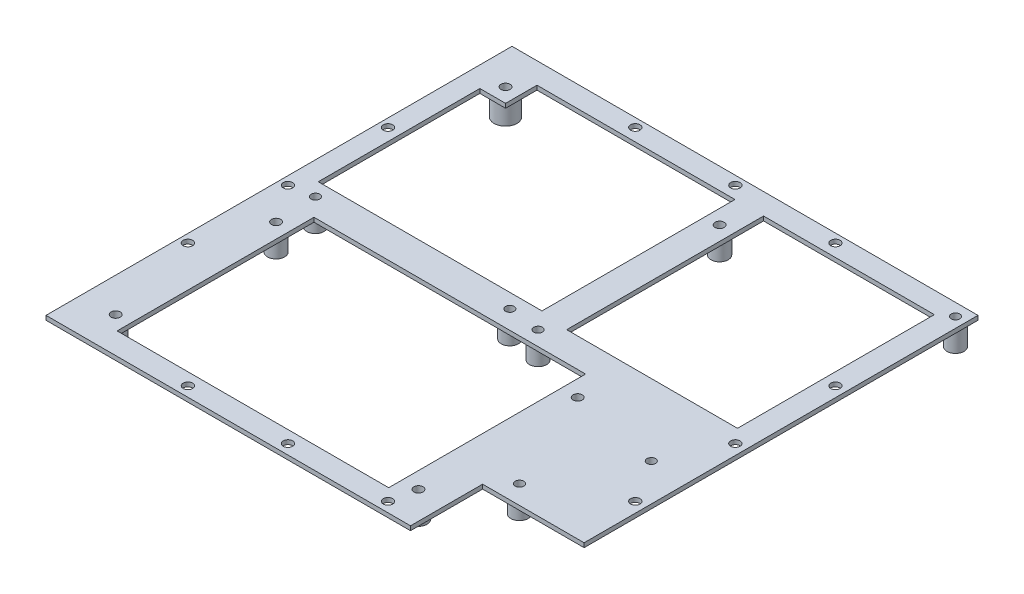
from build123d import *

# Parameters (mm, degrees)
CROQUIS1_R              = 1.6
CROQUIS1_R_2            = 1.65
CROQUIS1_W              = 95
CROQUIS1_H              = 68.859019413
CROQUIS1_R_3            = 1.5
CROQUIS1_W_2            = 59.75
SALIENTE_EXTRUIR2_DEPTH = 1.5
CROQUIS4_R              = 3
CROQUIS4_R_2            = 4
SALIENTE_EXTRUIR3_DEPTH = 7.6
CORTAR_EXTRUIR2_START   = -17.6
CROQUIS5_R              = 1.6
CROQUIS5_R_2            = 1.5
CORTAR_EXTRUIR2_DEPTH   = 17.6


with BuildPart() as part:
    # Croquis1 → Saliente-Extruir2 (new body)
    with BuildSketch(Plane(origin=(0, 0, 0), x_dir=(1, 0, 0), z_dir=(0, 1, 0))):
        Polygon((-81.153068025, 81.276875237), (-81.153068025, -81.723124763), (46.345958321, -81.723124763), (46.345958321, -56.5), (81.846931975, -56.5), (81.846931975, 81.276875237), align=None)
        with Locations(Location((-69.2, -69.3, 0), (0, 0, 270))):
            Circle(CROQUIS1_R, mode=Mode.SUBTRACT)
        with Locations(Location((-35, -78.25, 0), (0, 0, 270))):
            Circle(CROQUIS1_R_2, mode=Mode.SUBTRACT)
        with Locations(Location((0, -78.25, 0), (0, 0, 270))):
            Circle(CROQUIS1_R_2, mode=Mode.SUBTRACT)
        with Locations(Location((-78.25, -35, 0), (0, 0, 270))):
            Circle(CROQUIS1_R_2, mode=Mode.SUBTRACT)
        with Locations(Location((-69.2, -13.2, 0), (0, 0, 270))):
            Circle(CROQUIS1_R, mode=Mode.SUBTRACT)
        with Locations((-16.5, -39.570490294)):
            Rectangle(CROQUIS1_W, CROQUIS1_H, mode=Mode.SUBTRACT)
        with Locations(Location((35, -78.25, 0), (0, 0, 270))):
            Circle(CROQUIS1_R_2, mode=Mode.SUBTRACT)
        with Locations(Location((36.7, -69.3, 0), (0, 0, 270))):
            Circle(CROQUIS1_R, mode=Mode.SUBTRACT)
        with Locations(Location((52.645958321, -49.9, 0), (0, 0, 270))):
            Circle(CROQUIS1_R_3, mode=Mode.SUBTRACT)
        with Locations(Location((36.7, -13.6, 0), (0, 0, 270))):
            Circle(CROQUIS1_R, mode=Mode.SUBTRACT)
        with Locations(Location((78.25, -35, 0), (0, 0, 270))):
            Circle(CROQUIS1_R_2, mode=Mode.SUBTRACT)
        with Locations(Location((68.845958321, -20, 0), (0, 0, 270))):
            Circle(CROQUIS1_R_3, mode=Mode.SUBTRACT)
        with Locations(Location((-78.25, 0, 0), (0, 0, 270))):
            Circle(CROQUIS1_R_2, mode=Mode.SUBTRACT)
        with Locations(Location((-70, 1.359281772, 0), (0, 0, 270))):
            Circle(CROQUIS1_R_3, mode=Mode.SUBTRACT)
        with Locations(Location((-78.25, 35, 0), (0, 0, 270))):
            Circle(CROQUIS1_R_2, mode=Mode.SUBTRACT)
        with Locations(Location((-2, 1.359281772, 0), (0, 0, 270))):
            Circle(CROQUIS1_R_3, mode=Mode.SUBTRACT)
        Polygon((-74, 62.876032496), (-65, 62.876032496), (-65, 73.859019413), (4.25, 73.859019413), (4.25, 6.359281772), (-65, 6.359281772), (-74, 6.359281772), align=None, mode=Mode.SUBTRACT)
        with Locations(Location((-70, 67.859019413, 0), (0, 0, 270))):
            Circle(CROQUIS1_R_3, mode=Mode.SUBTRACT)
        with Locations(Location((-35, 78.25, 0), (0, 0, 270))):
            Circle(CROQUIS1_R_2, mode=Mode.SUBTRACT)
        with Locations(Location((0, 78.25, 0), (0, 0, 270))):
            Circle(CROQUIS1_R_2, mode=Mode.SUBTRACT)
        with Locations(Location((9.25, 0, 0), (0, 0, 270))):
            Circle(CROQUIS1_R_3, mode=Mode.SUBTRACT)
        with Locations(Location((78.25, 0, 0), (0, 0, 270))):
            Circle(CROQUIS1_R_2, mode=Mode.SUBTRACT)
        with Locations((44.125, 39.429509706)):
            Rectangle(CROQUIS1_W_2, CROQUIS1_H, mode=Mode.SUBTRACT)
        with Locations(Location((78.25, 35, 0), (0, 0, 270))):
            Circle(CROQUIS1_R_2, mode=Mode.SUBTRACT)
        with Locations(Location((9.25, 63.5, 0), (0, 0, 270))):
            Circle(CROQUIS1_R_3, mode=Mode.SUBTRACT)
        with Locations(Location((35, 78.25, 0), (0, 0, 270))):
            Circle(CROQUIS1_R_2, mode=Mode.SUBTRACT)
        with Locations(Location((78.25, 76.999306834, 0), (0, 0, 270))):
            Circle(CROQUIS1_R_3, mode=Mode.SUBTRACT)
    extrude(amount=SALIENTE_EXTRUIR2_DEPTH)

    # Croquis4 → Saliente-Extruir3 (add)
    with BuildSketch(Plane.XZ):
        with Locations(Location((-69.2, 69.3, 0), (0, 0, 90))):
            Circle(CROQUIS4_R)
        with Locations(Location((-69.2, 13.2, 0), (0, 0, 90))):
            Circle(CROQUIS4_R)
        with Locations(Location((36.7, 13.6, 0), (0, 0, 90))):
            Circle(CROQUIS4_R)
        with Locations(Location((52.645958321, 49.9, 0), (0, 0, 90))):
            Circle(CROQUIS4_R)
        with Locations(Location((68.845958321, 20, 0), (0, 0, 90))):
            Circle(CROQUIS4_R)
        with Locations(Location((9.25, 0, 0), (0, 0, 90))):
            Circle(CROQUIS4_R)
        with Locations(Location((-2, -1.359281772, 0), (0, 0, 90))):
            Circle(CROQUIS4_R)
        with Locations(Location((-70, -1.359281772, 0), (0, 0, 90))):
            Circle(CROQUIS4_R)
        with Locations(Location((-70, -67.859019413, 0), (0, 0, 90))):
            Circle(CROQUIS4_R_2)
        with Locations(Location((9.25, -63.5, 0), (0, 0, 90))):
            Circle(CROQUIS4_R)
        with Locations(Location((78.25, -76.999306834, 0), (0, 0, 90))):
            Circle(CROQUIS4_R)
        with Locations(Location((36.7, 69.3, 0), (0, 0, 90))):
            Circle(CROQUIS4_R)
    extrude(amount=SALIENTE_EXTRUIR3_DEPTH)

    # Croquis5 → Cortar-Extruir2 (cut)
    with BuildSketch(Plane(origin=(0, 1.5, 0), x_dir=(1, 0, 0), z_dir=(0, 1, 0)).offset(CORTAR_EXTRUIR2_START)):
        with Locations(Location((-69.2, -13.2, 0), (0, 0, 90))):
            Circle(CROQUIS5_R)
        with Locations(Location((-70, 1.359281772, 0), (0, 0, 90))):
            Circle(CROQUIS5_R_2)
        with Locations(Location((-2, 1.359281772, 0), (0, 0, 90))):
            Circle(CROQUIS5_R_2)
        with Locations(Location((9.25, 0, 0), (0, 0, 90))):
            Circle(CROQUIS5_R_2)
        with Locations(Location((36.7, -13.6, 0), (0, 0, 90))):
            Circle(CROQUIS5_R)
        with Locations(Location((36.7, -69.3, 0), (0, 0, 90))):
            Circle(CROQUIS5_R)
        with Locations(Location((52.645958321, -49.9, 0), (0, 0, 90))):
            Circle(CROQUIS5_R_2)
        with Locations(Location((68.845958321, -20, 0), (0, 0, 90))):
            Circle(CROQUIS5_R_2)
        with Locations(Location((9.25, 63.5, 0), (0, 0, 270))):
            Circle(CROQUIS5_R)
        with Locations(Location((-70, 67.859019413, 0), (0, 0, 270))):
            Circle(CROQUIS5_R)
        with Locations(Location((-69.2, -69.3, 0), (0, 0, 90))):
            Circle(CROQUIS5_R)
        with Locations(Location((78.25, 76.999306834, 0), (0, 0, 90))):
            Circle(CROQUIS5_R_2)
    extrude(amount=CORTAR_EXTRUIR2_DEPTH, mode=Mode.SUBTRACT)


solid = part.part
